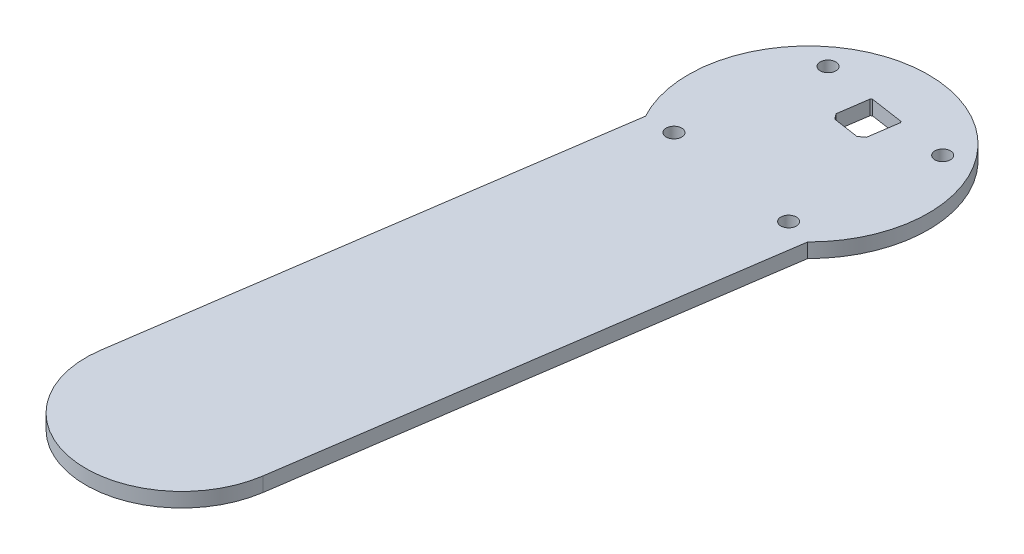
from build123d import *

# Parameters (mm, degrees)
EXTRUDE_1_DEPTH      = 6
SKETCH_6_R           = 3.25
CUT_EXTRUDE_3_DEPTH  = 28
CUT_EXTRUDE_11_DEPTH = 35


with BuildPart() as part:
    # 草图1 → 凸台-拉伸1 (new body)
    with BuildSketch(Plane(origin=(0, 0, 0), x_dir=(1, 0, 0), z_dir=(0, 1, 0))):
        with BuildLine():
            Line((-43.933694981, -23.871121576), (-72.986973894, -221.749637298))
            ThreePointArc((-72.986973894, -221.749637298), (-39.221926532, -267.135996225), (6.164432395, -233.370948863))
            Line((6.164432395, -233.370948863), (35.217711308, -35.492433141))
            ThreePointArc((35.217711308, -35.492433141), (7.263319728, 49.469628931), (-43.933694981, -23.871121576))
        make_face()
    extrude(amount=EXTRUDE_1_DEPTH)

    # 草图6 → 切除-拉伸3 (cut)
    with BuildSketch(Plane.XZ):
        with Locations(Location((-32.093002168, 23.87549396, 0), (0, 0, 270))):
            Circle(SKETCH_6_R)
        with Locations(Location((23.87549396, 32.093002168, 0), (0, 0, 270))):
            Circle(SKETCH_6_R)
        with Locations(Location((32.093002168, -23.87549396, 0), (0, 0, 270))):
            Circle(SKETCH_6_R)
        with Locations(Location((-23.87549396, -32.093002168, 0), (0, 0, 270))):
            Circle(SKETCH_6_R)
    extrude(amount=-CUT_EXTRUDE_3_DEPTH, mode=Mode.SUBTRACT)

    # 草图11 → 切除-拉伸11 (cut)
    with BuildSketch(Plane(origin=(0, 6, 0), x_dir=(1, 0, 0), z_dir=(0, 1, 0))):
        Polygon((9.713368511, 14.527342871), (11.529198442, 26.894750104), (11.10713535, 27.462079591), (-2.744360751, 29.495809113), (-3.311690238, 29.073746021), (-5.127520168, 16.706338788), (-3.4392678, 14.437020842), (7.444050565, 12.839090503), align=None)
    extrude(amount=-CUT_EXTRUDE_11_DEPTH, mode=Mode.SUBTRACT)


solid = part.part
